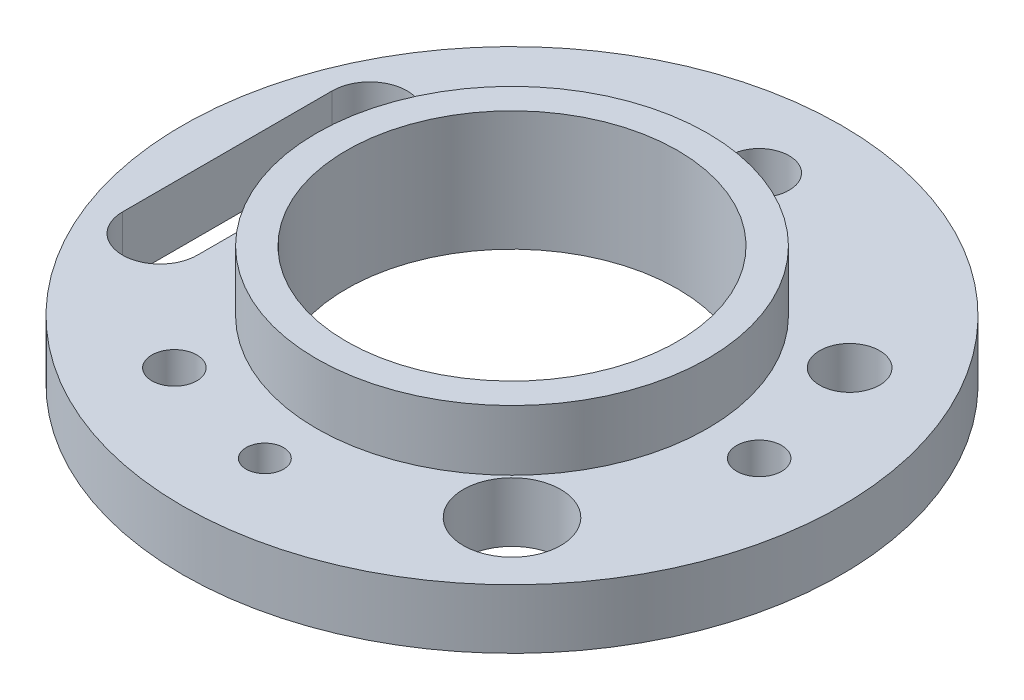
from build123d import *

# Parameters (mm, degrees)
SKETCH3_R          = 1.5
SKETCH3_R_2        = 3.25
SKETCH3_R_3        = 2
SKETCH3_R_4        = 1.25
CUT_EXTRUDE1_DEPTH = 10


with BuildPart() as part:
    # Sketch1 → Revolve1 (revolve)
    with BuildSketch(Plane.XY, mode=Mode.PRIVATE) as revolve1_sk:
        Polygon((11.05, 0), (11.05, 8), (13.05, 8), (13.05, 3.969255392), (22, 3.969255392), (22, 0), align=None)
    revolve(revolve1_sk.sketch.rotate(Axis((0, 0, 0), (0, 1, 0)), 90), axis=Axis((0, 0, 0), (0, 1, 0)))

    # Sketch3 → Cut-Extrude1 (cut)
    with BuildSketch(Plane(origin=(0, 0, 0), x_dir=(1, 0, 0), z_dir=(0, 1, 0))):
        with Locations(Location((16.5, 0, 0), (0, 0, 270))):
            Circle(SKETCH3_R)
        with Locations(Location((-8.25, -14.289419162, 0), (0, 0, 270))):
            Circle(SKETCH3_R)
        with Locations(Location((-8.25, 14.289419162, 0), (0, 0, 270))):
            Circle(SKETCH3_R)
        with Locations(Location((11.66726189, -11.66726189, 0), (0, 0, 270))):
            Circle(SKETCH3_R_2)
        with Locations(Location((14.289419162, 8.25, 0), (0, 0, 270))):
            Circle(SKETCH3_R_3)
        with Locations(Location((0, 16.5, 0), (0, 0, 270))):
            Circle(SKETCH3_R_3)
        with Locations(Location((0, -16.5, 0), (0, 0, 270))):
            Circle(SKETCH3_R_4)
        with BuildLine():
            Line((-14, -7), (-14, 7))
            ThreePointArc((-14, 7), (-16.5, 9.5), (-19, 7))
            Line((-19, 7), (-19, -7))
            ThreePointArc((-19, -7), (-16.5, -9.5), (-14, -7))
        make_face()
    extrude(amount=CUT_EXTRUDE1_DEPTH, mode=Mode.SUBTRACT)


solid = part.part
